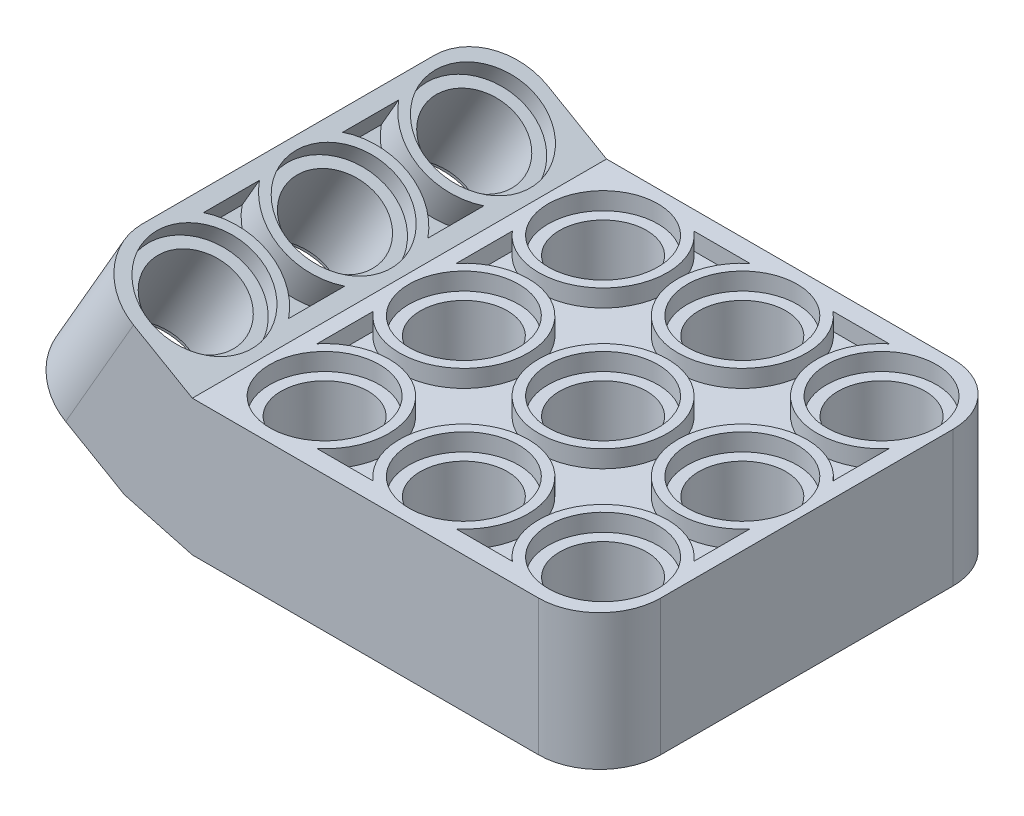
from build123d import *

# Parameters (mm, degrees)
SKETCH_1_W                  = 23.4
SKETCH_1_H                  = 7.8
EXTRUDE_1_DEPTH             = 23.8
CUT_EXTRUDE_1_REACH         = 37.953
CUT_EXTRUDE_2_DEPTH         = 1
CUT_EXTRUDE_START           = -6.8
CUT_EXTRUDE_3_DEPTH         = 1
PATTERN_LINEAR_1_COUNT      = 2
PATTERN_LINEAR_1_PITCH      = 8
PATTERN_LINEAR_1_COL_COUNT  = 2
PATTERN_LINEAR_1_COL_PITCH  = 8
CUT_EXTRUDE_4_DEPTH         = 2
CUT_EXTRUDE_START_2         = -5.8
CUT_EXTRUDE_5_DEPTH         = 2
PATTERN_LINEAR_2_COUNT      = 2
PATTERN_LINEAR_2_PITCH      = 8
CUT_EXTRUDE_6_REACH         = 37.302
SKETCH_5_R                  = 2.5
SKETCH_5_3_R                = 3.15
SKETCH_5_3_R_2              = 2.5
CUT_EXTRUDE_7_DEPTH         = 1
SKETCH_5_4_R                = 3.15
SKETCH_5_4_R_2              = 2.5
CUT_EXTRUDE_8_DEPTH         = 1
PATTERN_LINEAR_3_COUNT      = 2
PATTERN_LINEAR_3_PITCH      = 8
PATTERN_LINEAR_3_COL_COUNT  = 2
PATTERN_LINEAR_3_COL_PITCH  = 8
CUT_EXTRUDE_10_DEPTH        = 1
CUT_EXTRUDE_11_DEPTH        = 1
PATTERN_LINEAR_4_COUNT      = 2
PATTERN_LINEAR_4_PITCH      = 8
PATTERN_LINEAR_4_COUNT_DIR2 = 3
PATTERN_LINEAR_4_PITCH_DIR2 = 8
CUT_EXTRUDE_12_DEPTH        = 1
CUT_EXTRUDE_13_DEPTH        = 1
PATTERN_LINEAR_5_COUNT      = 3
PATTERN_LINEAR_5_PITCH      = 8
PATTERN_LINEAR_5_COUNT_DIR2 = 2
PATTERN_LINEAR_5_PITCH_DIR2 = 8
SKETCH_6_W                  = 2.35
SKETCH_6_H                  = 2.35
CUT_EXTRUDE_14_DEPTH        = 1
CUT_EXTRUDE_START_3         = -7.8
SKETCH_6_2_W                = 2.35
SKETCH_6_2_H                = 2.35
CUT_EXTRUDE_15_DEPTH        = 1
FILLET_1_R                  = 3.5


with BuildPart() as part:
    # 草图1 → 凸台-拉伸1 (new body)
    with BuildSketch(Plane.XY):
        Polygon((-6.408587988, 11.5), (0, 7.8), (-3.9, 1.04500185), (-10.308587988, 4.74500185), align=None)
        with Locations((11.7, 3.9)):
            Rectangle(SKETCH_1_W, SKETCH_1_H)
        Polygon((-3.9, 1.04500185), (0, 7.8), (0, 0), align=None)
    extrude(amount=EXTRUDE_1_DEPTH)

    # 草图2 → 切除-拉伸1 (cut, up to next)
    with BuildSketch(Plane(origin=(-0.522500925, -0.90499815, 0), x_dir=(-0.8660254037844388, 0.49999999999999967, 0), z_dir=(-0.49999999999999967, -0.8660254037844388, 0)), mode=Mode.PRIVATE) as cut_extrude_1_sk1:
        with BuildLine():
            ThreePointArc((5.1, -11.9), (5.832233047, -13.667766953), (7.6, -14.4))
            Line((7.6, -14.4), (7.6, -11.9))
            Line((7.6, -11.9), (5.1, -11.9))
        make_face()
    cut_extrude_1_tool1 = extrude(cut_extrude_1_sk1.sketch, amount=-CUT_EXTRUDE_1_REACH, mode=Mode.PRIVATE) & part.part
    # 草图2 → 切除-拉伸1 (cut, up to next)
    with BuildSketch(Plane(origin=(-0.522500925, -0.90499815, 0), x_dir=(-0.8660254037844388, 0.49999999999999967, 0), z_dir=(-0.49999999999999967, -0.8660254037844388, 0)), mode=Mode.PRIVATE) as cut_extrude_1_sk2:
        with BuildLine():
            Line((7.6, -11.9), (7.6, -14.4))
            ThreePointArc((7.6, -14.4), (9.367766953, -13.667766953), (10.1, -11.9))
            Line((10.1, -11.9), (7.6, -11.9))
        make_face()
    cut_extrude_1_tool2 = extrude(cut_extrude_1_sk2.sketch, amount=-CUT_EXTRUDE_1_REACH, mode=Mode.PRIVATE) & part.part
    # 草图2 → 切除-拉伸1 (cut, up to next)
    with BuildSketch(Plane(origin=(-0.522500925, -0.90499815, 0), x_dir=(-0.8660254037844388, 0.49999999999999967, 0), z_dir=(-0.49999999999999967, -0.8660254037844388, 0)), mode=Mode.PRIVATE) as cut_extrude_1_sk3:
        with BuildLine():
            Line((5.1, -11.9), (7.6, -11.9))
            Line((7.6, -11.9), (7.6, -9.4))
            ThreePointArc((7.6, -9.4), (5.832233047, -10.132233047), (5.1, -11.9))
        make_face()
    cut_extrude_1_tool3 = extrude(cut_extrude_1_sk3.sketch, amount=-CUT_EXTRUDE_1_REACH, mode=Mode.PRIVATE) & part.part
    # 草图2 → 切除-拉伸1 (cut, up to next)
    with BuildSketch(Plane(origin=(-0.522500925, -0.90499815, 0), x_dir=(-0.8660254037844388, 0.49999999999999967, 0), z_dir=(-0.49999999999999967, -0.8660254037844388, 0)), mode=Mode.PRIVATE) as cut_extrude_1_sk4:
        with BuildLine():
            Line((7.6, -9.4), (7.6, -11.9))
            Line((7.6, -11.9), (10.1, -11.9))
            ThreePointArc((10.1, -11.9), (9.367766953, -10.132233047), (7.6, -9.4))
        make_face()
    cut_extrude_1_tool4 = extrude(cut_extrude_1_sk4.sketch, amount=-CUT_EXTRUDE_1_REACH, mode=Mode.PRIVATE) & part.part
    # 草图2 → 切除-拉伸1 (cut, up to next)
    with BuildSketch(Plane(origin=(-0.522500925, -0.90499815, 0), x_dir=(-0.8660254037844388, 0.49999999999999967, 0), z_dir=(-0.49999999999999967, -0.8660254037844388, 0)), mode=Mode.PRIVATE) as cut_extrude_1_sk5:
        with BuildLine():
            ThreePointArc((5.1, -11.9), (5.832233047, -13.667766953), (7.6, -14.4))
            Line((7.6, -14.4), (7.6, -11.9))
            Line((7.6, -11.9), (5.1, -11.9))
        make_face()
    cut_extrude_1_tool5 = extrude(cut_extrude_1_sk5.sketch, amount=-CUT_EXTRUDE_1_REACH, mode=Mode.PRIVATE) & part.part
    # 草图2 → 切除-拉伸1 (cut, up to next)
    with BuildSketch(Plane(origin=(-0.522500925, -0.90499815, 0), x_dir=(-0.8660254037844388, 0.49999999999999967, 0), z_dir=(-0.49999999999999967, -0.8660254037844388, 0)), mode=Mode.PRIVATE) as cut_extrude_1_sk6:
        with BuildLine():
            Line((7.6, -11.9), (7.6, -14.4))
            ThreePointArc((7.6, -14.4), (9.367766953, -13.667766953), (10.1, -11.9))
            Line((10.1, -11.9), (7.6, -11.9))
        make_face()
    cut_extrude_1_tool6 = extrude(cut_extrude_1_sk6.sketch, amount=-CUT_EXTRUDE_1_REACH, mode=Mode.PRIVATE) & part.part
    # 草图2 → 切除-拉伸1 (cut, up to next)
    with BuildSketch(Plane(origin=(-0.522500925, -0.90499815, 0), x_dir=(-0.8660254037844388, 0.49999999999999967, 0), z_dir=(-0.49999999999999967, -0.8660254037844388, 0)), mode=Mode.PRIVATE) as cut_extrude_1_sk7:
        with BuildLine():
            Line((5.1, -11.9), (7.6, -11.9))
            Line((7.6, -11.9), (7.6, -9.4))
            ThreePointArc((7.6, -9.4), (5.832233047, -10.132233047), (5.1, -11.9))
        make_face()
    cut_extrude_1_tool7 = extrude(cut_extrude_1_sk7.sketch, amount=-CUT_EXTRUDE_1_REACH, mode=Mode.PRIVATE) & part.part
    # 草图2 → 切除-拉伸1 (cut, up to next)
    with BuildSketch(Plane(origin=(-0.522500925, -0.90499815, 0), x_dir=(-0.8660254037844388, 0.49999999999999967, 0), z_dir=(-0.49999999999999967, -0.8660254037844388, 0)), mode=Mode.PRIVATE) as cut_extrude_1_sk8:
        with BuildLine():
            Line((7.6, -9.4), (7.6, -11.9))
            Line((7.6, -11.9), (10.1, -11.9))
            ThreePointArc((10.1, -11.9), (9.367766953, -10.132233047), (7.6, -9.4))
        make_face()
    cut_extrude_1_tool8 = extrude(cut_extrude_1_sk8.sketch, amount=-CUT_EXTRUDE_1_REACH, mode=Mode.PRIVATE) & part.part
    # 草图2 → 切除-拉伸1 (cut, up to next)
    with BuildSketch(Plane(origin=(-0.522500925, -0.90499815, 0), x_dir=(-0.8660254037844388, 0.49999999999999967, 0), z_dir=(-0.49999999999999967, -0.8660254037844388, 0)), mode=Mode.PRIVATE) as cut_extrude_1_sk9:
        with BuildLine():
            ThreePointArc((5.1, -11.9), (5.832233047, -13.667766953), (7.6, -14.4))
            Line((7.6, -14.4), (7.6, -11.9))
            Line((7.6, -11.9), (5.1, -11.9))
        make_face()
    cut_extrude_1_tool9 = extrude(cut_extrude_1_sk9.sketch, amount=-CUT_EXTRUDE_1_REACH, mode=Mode.PRIVATE) & part.part
    # 草图2 → 切除-拉伸1 (cut, up to next)
    with BuildSketch(Plane(origin=(-0.522500925, -0.90499815, 0), x_dir=(-0.8660254037844388, 0.49999999999999967, 0), z_dir=(-0.49999999999999967, -0.8660254037844388, 0)), mode=Mode.PRIVATE) as cut_extrude_1_sk10:
        with BuildLine():
            Line((7.6, -11.9), (7.6, -14.4))
            ThreePointArc((7.6, -14.4), (9.367766953, -13.667766953), (10.1, -11.9))
            Line((10.1, -11.9), (7.6, -11.9))
        make_face()
    cut_extrude_1_tool10 = extrude(cut_extrude_1_sk10.sketch, amount=-CUT_EXTRUDE_1_REACH, mode=Mode.PRIVATE) & part.part
    # 草图2 → 切除-拉伸1 (cut, up to next)
    with BuildSketch(Plane(origin=(-0.522500925, -0.90499815, 0), x_dir=(-0.8660254037844388, 0.49999999999999967, 0), z_dir=(-0.49999999999999967, -0.8660254037844388, 0)), mode=Mode.PRIVATE) as cut_extrude_1_sk11:
        with BuildLine():
            Line((5.1, -11.9), (7.6, -11.9))
            Line((7.6, -11.9), (7.6, -9.4))
            ThreePointArc((7.6, -9.4), (5.832233047, -10.132233047), (5.1, -11.9))
        make_face()
    cut_extrude_1_tool11 = extrude(cut_extrude_1_sk11.sketch, amount=-CUT_EXTRUDE_1_REACH, mode=Mode.PRIVATE) & part.part
    # 草图2 → 切除-拉伸1 (cut, up to next)
    with BuildSketch(Plane(origin=(-0.522500925, -0.90499815, 0), x_dir=(-0.8660254037844388, 0.49999999999999967, 0), z_dir=(-0.49999999999999967, -0.8660254037844388, 0)), mode=Mode.PRIVATE) as cut_extrude_1_sk12:
        with BuildLine():
            Line((7.6, -9.4), (7.6, -11.9))
            Line((7.6, -11.9), (10.1, -11.9))
            ThreePointArc((10.1, -11.9), (9.367766953, -10.132233047), (7.6, -9.4))
        make_face()
    cut_extrude_1_tool12 = extrude(cut_extrude_1_sk12.sketch, amount=-CUT_EXTRUDE_1_REACH, mode=Mode.PRIVATE) & part.part
    # 草图2 → 切除-拉伸1 (cut, up to next)
    with BuildSketch(Plane(origin=(-0.522500925, -0.90499815, 0), x_dir=(-0.8660254037844388, 0.49999999999999967, 0), z_dir=(-0.49999999999999967, -0.8660254037844388, 0)), mode=Mode.PRIVATE) as cut_extrude_1_sk13:
        with BuildLine():
            ThreePointArc((5.1, -11.9), (5.832233047, -13.667766953), (7.6, -14.4))
            Line((7.6, -14.4), (7.6, -11.9))
            Line((7.6, -11.9), (5.1, -11.9))
        make_face()
    cut_extrude_1_tool13 = extrude(cut_extrude_1_sk13.sketch, amount=-CUT_EXTRUDE_1_REACH, mode=Mode.PRIVATE) & part.part
    # 草图2 → 切除-拉伸1 (cut, up to next)
    with BuildSketch(Plane(origin=(-0.522500925, -0.90499815, 0), x_dir=(-0.8660254037844388, 0.49999999999999967, 0), z_dir=(-0.49999999999999967, -0.8660254037844388, 0)), mode=Mode.PRIVATE) as cut_extrude_1_sk14:
        with BuildLine():
            Line((7.6, -11.9), (7.6, -14.4))
            ThreePointArc((7.6, -14.4), (9.367766953, -13.667766953), (10.1, -11.9))
            Line((10.1, -11.9), (7.6, -11.9))
        make_face()
    cut_extrude_1_tool14 = extrude(cut_extrude_1_sk14.sketch, amount=-CUT_EXTRUDE_1_REACH, mode=Mode.PRIVATE) & part.part
    # 草图2 → 切除-拉伸1 (cut, up to next)
    with BuildSketch(Plane(origin=(-0.522500925, -0.90499815, 0), x_dir=(-0.8660254037844388, 0.49999999999999967, 0), z_dir=(-0.49999999999999967, -0.8660254037844388, 0)), mode=Mode.PRIVATE) as cut_extrude_1_sk15:
        with BuildLine():
            Line((5.1, -11.9), (7.6, -11.9))
            Line((7.6, -11.9), (7.6, -9.4))
            ThreePointArc((7.6, -9.4), (5.832233047, -10.132233047), (5.1, -11.9))
        make_face()
    cut_extrude_1_tool15 = extrude(cut_extrude_1_sk15.sketch, amount=-CUT_EXTRUDE_1_REACH, mode=Mode.PRIVATE) & part.part
    # 草图2 → 切除-拉伸1 (cut, up to next)
    with BuildSketch(Plane(origin=(-0.522500925, -0.90499815, 0), x_dir=(-0.8660254037844388, 0.49999999999999967, 0), z_dir=(-0.49999999999999967, -0.8660254037844388, 0)), mode=Mode.PRIVATE) as cut_extrude_1_sk16:
        with BuildLine():
            Line((7.6, -9.4), (7.6, -11.9))
            Line((7.6, -11.9), (10.1, -11.9))
            ThreePointArc((10.1, -11.9), (9.367766953, -10.132233047), (7.6, -9.4))
        make_face()
    cut_extrude_1_tool16 = extrude(cut_extrude_1_sk16.sketch, amount=-CUT_EXTRUDE_1_REACH, mode=Mode.PRIVATE) & part.part
    cut_extrude_1_1 = cut_extrude_1_tool1.solids().sort_by_distance((-6.185413, 2.364485, 12.961033))[0]
    add(cut_extrude_1_1, mode=Mode.SUBTRACT)
    cut_extrude_1_2 = cut_extrude_1_tool2.solids().sort_by_distance((-8.023175, 3.425518, 12.961033))[0]
    add(cut_extrude_1_2, mode=Mode.SUBTRACT)
    cut_extrude_1_3 = cut_extrude_1_tool3.solids().sort_by_distance((-6.185413, 2.364485, 10.838967))[0]
    add(cut_extrude_1_3, mode=Mode.SUBTRACT)
    cut_extrude_1_4 = cut_extrude_1_tool4.solids().sort_by_distance((-8.023175, 3.425518, 10.838967))[0]
    add(cut_extrude_1_4, mode=Mode.SUBTRACT)
    cut_extrude_1_5 = cut_extrude_1_tool5.solids().sort_by_distance((-6.185413, 2.364485, 12.961033))[0]
    add(cut_extrude_1_5, mode=Mode.SUBTRACT)
    cut_extrude_1_6 = cut_extrude_1_tool6.solids().sort_by_distance((-8.023175, 3.425518, 12.961033))[0]
    add(cut_extrude_1_6, mode=Mode.SUBTRACT)
    cut_extrude_1_7 = cut_extrude_1_tool7.solids().sort_by_distance((-6.185413, 2.364485, 10.838967))[0]
    add(cut_extrude_1_7, mode=Mode.SUBTRACT)
    cut_extrude_1_8 = cut_extrude_1_tool8.solids().sort_by_distance((-8.023175, 3.425518, 10.838967))[0]
    add(cut_extrude_1_8, mode=Mode.SUBTRACT)
    cut_extrude_1_9 = cut_extrude_1_tool9.solids().sort_by_distance((-6.185413, 2.364485, 12.961033))[0]
    add(cut_extrude_1_9, mode=Mode.SUBTRACT)
    cut_extrude_1_10 = cut_extrude_1_tool10.solids().sort_by_distance((-8.023175, 3.425518, 12.961033))[0]
    add(cut_extrude_1_10, mode=Mode.SUBTRACT)
    cut_extrude_1_11 = cut_extrude_1_tool11.solids().sort_by_distance((-6.185413, 2.364485, 10.838967))[0]
    add(cut_extrude_1_11, mode=Mode.SUBTRACT)
    cut_extrude_1_12 = cut_extrude_1_tool12.solids().sort_by_distance((-8.023175, 3.425518, 10.838967))[0]
    add(cut_extrude_1_12, mode=Mode.SUBTRACT)
    cut_extrude_1_13 = cut_extrude_1_tool13.solids().sort_by_distance((-6.185413, 2.364485, 12.961033))[0]
    add(cut_extrude_1_13, mode=Mode.SUBTRACT)
    cut_extrude_1_14 = cut_extrude_1_tool14.solids().sort_by_distance((-8.023175, 3.425518, 12.961033))[0]
    add(cut_extrude_1_14, mode=Mode.SUBTRACT)
    cut_extrude_1_15 = cut_extrude_1_tool15.solids().sort_by_distance((-6.185413, 2.364485, 10.838967))[0]
    add(cut_extrude_1_15, mode=Mode.SUBTRACT)
    cut_extrude_1_16 = cut_extrude_1_tool16.solids().sort_by_distance((-8.023175, 3.425518, 10.838967))[0]
    add(cut_extrude_1_16, mode=Mode.SUBTRACT)
    cut_extrude_1 = cut_extrude_1_1 + cut_extrude_1_2 + cut_extrude_1_3 + cut_extrude_1_4 + cut_extrude_1_5 + cut_extrude_1_6 + cut_extrude_1_7 + cut_extrude_1_8 + cut_extrude_1_9 + cut_extrude_1_10 + cut_extrude_1_11 + cut_extrude_1_12 + cut_extrude_1_13 + cut_extrude_1_14 + cut_extrude_1_15 + cut_extrude_1_16  # 切除-拉伸1 as one shape, for the pattern or mirror that repeats it

    # 草图2<3> → 切除-拉伸2 (cut)
    with BuildSketch(Plane(origin=(-0.522500925, -0.90499815, 0), x_dir=(-0.8660254037844388, 0.49999999999999967, 0), z_dir=(-0.49999999999999967, -0.8660254037844388, 0))):
        with BuildLine():
            ThreePointArc((4.45, -11.9), (5.372613639, -14.127386361), (7.6, -15.05))
            Line((7.6, -15.05), (7.6, -14.4))
            ThreePointArc((7.6, -14.4), (5.832233047, -13.667766953), (5.1, -11.9))
            Line((5.1, -11.9), (4.45, -11.9))
        make_face()
        with BuildLine():
            Line((7.6, -14.4), (7.6, -15.05))
            ThreePointArc((7.6, -15.05), (9.827386361, -14.127386361), (10.75, -11.9))
            Line((10.75, -11.9), (10.1, -11.9))
            ThreePointArc((10.1, -11.9), (9.367766953, -13.667766953), (7.6, -14.4))
        make_face()
        with BuildLine():
            ThreePointArc((7.6, -8.75), (5.372613639, -9.672613639), (4.45, -11.9))
            Line((4.45, -11.9), (5.1, -11.9))
            ThreePointArc((5.1, -11.9), (5.832233047, -10.132233047), (7.6, -9.4))
            Line((7.6, -9.4), (7.6, -8.75))
        make_face()
        with BuildLine():
            Line((10.1, -11.9), (10.75, -11.9))
            ThreePointArc((10.75, -11.9), (9.827386361, -9.672613639), (7.6, -8.75))
            Line((7.6, -8.75), (7.6, -9.4))
            ThreePointArc((7.6, -9.4), (9.367766953, -10.132233047), (10.1, -11.9))
        make_face()
    cut_extrude_2 = extrude(amount=-CUT_EXTRUDE_2_DEPTH, mode=Mode.SUBTRACT)

    # 草图2<4> → 切除-拉伸3 (cut)
    with BuildSketch(Plane(origin=(-0.522500925, -0.90499815, 0), x_dir=(-0.8660254037844388, 0.49999999999999967, 0), z_dir=(-0.49999999999999967, -0.8660254037844388, 0)).offset(CUT_EXTRUDE_START)):
        with BuildLine():
            ThreePointArc((4.45, -11.9), (5.372613639, -14.127386361), (7.6, -15.05))
            Line((7.6, -15.05), (7.6, -14.4))
            ThreePointArc((7.6, -14.4), (5.832233047, -13.667766953), (5.1, -11.9))
            Line((5.1, -11.9), (4.45, -11.9))
        make_face()
        with BuildLine():
            Line((7.6, -14.4), (7.6, -15.05))
            ThreePointArc((7.6, -15.05), (9.827386361, -14.127386361), (10.75, -11.9))
            Line((10.75, -11.9), (10.1, -11.9))
            ThreePointArc((10.1, -11.9), (9.367766953, -13.667766953), (7.6, -14.4))
        make_face()
        with BuildLine():
            ThreePointArc((7.6, -8.75), (5.372613639, -9.672613639), (4.45, -11.9))
            Line((4.45, -11.9), (5.1, -11.9))
            ThreePointArc((5.1, -11.9), (5.832233047, -10.132233047), (7.6, -9.4))
            Line((7.6, -9.4), (7.6, -8.75))
        make_face()
        with BuildLine():
            Line((10.1, -11.9), (10.75, -11.9))
            ThreePointArc((10.75, -11.9), (9.827386361, -9.672613639), (7.6, -8.75))
            Line((7.6, -8.75), (7.6, -9.4))
            ThreePointArc((7.6, -9.4), (9.367766953, -10.132233047), (10.1, -11.9))
        make_face()
    cut_extrude_3 = extrude(amount=-CUT_EXTRUDE_3_DEPTH, mode=Mode.SUBTRACT)

    # 阵列(线性)1: 切除-拉伸1, 切除-拉伸2, 切除-拉伸3 ×2
    with Locations(*[(0, 0, -i * PATTERN_LINEAR_1_PITCH) for i in range(1, PATTERN_LINEAR_1_COUNT)]):
        add(cut_extrude_1, mode=Mode.SUBTRACT)
        add(cut_extrude_2, mode=Mode.SUBTRACT)
        add(cut_extrude_3, mode=Mode.SUBTRACT)

    # 阵列(线性)1 col: 切除-拉伸1, 切除-拉伸2, 切除-拉伸3 ×2
    with Locations(*[(0, 0, i * PATTERN_LINEAR_1_COL_PITCH) for i in range(1, PATTERN_LINEAR_1_COL_COUNT)]):
        add(cut_extrude_1, mode=Mode.SUBTRACT)
        add(cut_extrude_2, mode=Mode.SUBTRACT)
        add(cut_extrude_3, mode=Mode.SUBTRACT)

    # 草图4 → 切除-拉伸4 (cut)
    with BuildSketch(Plane(origin=(-0.522500925, -0.90499815, 0), x_dir=(0.8660254037844384, -0.5000000000000006, 0), z_dir=(-0.5000000000000006, -0.8660254037844384, 0))):
        with BuildLine():
            ThreePointArc((-7.6, 8.2), (-9.157098192, 8.543596386), (-10.425, 9.510570152))
            Line((-10.425, 9.510570152), (-10.425, 6.289429848))
            ThreePointArc((-10.425, 6.289429848), (-9.157098192, 7.256403614), (-7.6, 7.6))
            Line((-7.6, 7.6), (-7.6, 8.2))
        make_face()
        with BuildLine():
            Line((-4.775, 6.289429848), (-4.775, 9.510570152))
            ThreePointArc((-4.775, 9.510570152), (-6.042901808, 8.543596386), (-7.6, 8.2))
            Line((-7.6, 8.2), (-7.6, 7.6))
            ThreePointArc((-7.6, 7.6), (-6.042901808, 7.256403614), (-4.775, 6.289429848))
        make_face()
    cut_extrude_4 = extrude(amount=-CUT_EXTRUDE_4_DEPTH, mode=Mode.SUBTRACT)

    # 草图4<3> → 切除-拉伸5 (cut)
    with BuildSketch(Plane(origin=(-0.522500925, -0.90499815, 0), x_dir=(0.8660254037844384, -0.5000000000000006, 0), z_dir=(-0.5000000000000006, -0.8660254037844384, 0)).offset(CUT_EXTRUDE_START_2)):
        with BuildLine():
            ThreePointArc((-7.6, 8.2), (-9.157098192, 8.543596386), (-10.425, 9.510570152))
            Line((-10.425, 9.510570152), (-10.425, 6.289429848))
            ThreePointArc((-10.425, 6.289429848), (-9.157098192, 7.256403614), (-7.6, 7.6))
            Line((-7.6, 7.6), (-7.6, 8.2))
        make_face()
        with BuildLine():
            Line((-4.775, 6.289429848), (-4.775, 9.510570152))
            ThreePointArc((-4.775, 9.510570152), (-6.042901808, 8.543596386), (-7.6, 8.2))
            Line((-7.6, 8.2), (-7.6, 7.6))
            ThreePointArc((-7.6, 7.6), (-6.042901808, 7.256403614), (-4.775, 6.289429848))
        make_face()
    cut_extrude_5 = extrude(amount=-CUT_EXTRUDE_5_DEPTH, mode=Mode.SUBTRACT)

    # 阵列(线性)2: 切除-拉伸4, 切除-拉伸5 ×2
    with Locations(*[(0, 0, i * PATTERN_LINEAR_2_PITCH) for i in range(1, PATTERN_LINEAR_2_COUNT)]):
        add(cut_extrude_4, mode=Mode.SUBTRACT)
        add(cut_extrude_5, mode=Mode.SUBTRACT)

    # 草图5 → 切除-拉伸6 (cut, up to next)
    with BuildSketch(Plane.XZ, mode=Mode.PRIVATE) as cut_extrude_6_sk1:
        with Locations(Location((11.7, 11.9, 0), (0, 0, 270))):
            Circle(SKETCH_5_R)
    cut_extrude_6_tool1 = extrude(cut_extrude_6_sk1.sketch, amount=-CUT_EXTRUDE_6_REACH, mode=Mode.PRIVATE) & part.part
    # 草图5 → 切除-拉伸6 (cut, up to next)
    with BuildSketch(Plane.XZ, mode=Mode.PRIVATE) as cut_extrude_6_sk2:
        with Locations(Location((19.7, 11.9, 0), (0, 0, 270))):
            Circle(SKETCH_5_R)
    cut_extrude_6_tool2 = extrude(cut_extrude_6_sk2.sketch, amount=-CUT_EXTRUDE_6_REACH, mode=Mode.PRIVATE) & part.part
    # 草图5 → 切除-拉伸6 (cut, up to next)
    with BuildSketch(Plane.XZ, mode=Mode.PRIVATE) as cut_extrude_6_sk3:
        with Locations(Location((3.7, 11.9, 0), (0, 0, 270))):
            Circle(SKETCH_5_R)
    cut_extrude_6_tool3 = extrude(cut_extrude_6_sk3.sketch, amount=-CUT_EXTRUDE_6_REACH, mode=Mode.PRIVATE) & part.part
    cut_extrude_6_1 = cut_extrude_6_tool1.solids().sort_by_distance((11.7, 0, 11.9))[0]
    add(cut_extrude_6_1, mode=Mode.SUBTRACT)
    cut_extrude_6_2 = cut_extrude_6_tool2.solids().sort_by_distance((19.7, 0, 11.9))[0]
    add(cut_extrude_6_2, mode=Mode.SUBTRACT)
    cut_extrude_6_3 = cut_extrude_6_tool3.solids().sort_by_distance((3.7, 0, 11.9))[0]
    add(cut_extrude_6_3, mode=Mode.SUBTRACT)
    cut_extrude_6 = cut_extrude_6_1 + cut_extrude_6_2 + cut_extrude_6_3  # 切除-拉伸6 as one shape, for the pattern or mirror that repeats it

    # 草图5<3> → 切除-拉伸7 (cut)
    # profile 1 of 3: a face of its own
    with BuildSketch(Plane.XZ):
        with Locations(Location((3.7, 11.9, 0), (0, 0, 270))):
            Circle(SKETCH_5_3_R)
        with Locations(Location((3.7, 11.9, 0), (0, 0, 270))):
            Circle(SKETCH_5_3_R_2, mode=Mode.SUBTRACT)
    # profile 2 of 3: a face of its own
    with BuildSketch(Plane.XZ):
        with Locations(Location((19.7, 11.9, 0), (0, 0, 270))):
            Circle(SKETCH_5_3_R)
        with Locations(Location((19.7, 11.9, 0), (0, 0, 270))):
            Circle(SKETCH_5_3_R_2, mode=Mode.SUBTRACT)
    # profile 3 of 3: a face of its own
    with BuildSketch(Plane.XZ):
        with Locations(Location((11.7, 11.9, 0), (0, 0, 270))):
            Circle(SKETCH_5_3_R)
        with Locations(Location((11.7, 11.9, 0), (0, 0, 270))):
            Circle(SKETCH_5_3_R_2, mode=Mode.SUBTRACT)
    cut_extrude_7 = extrude(amount=-CUT_EXTRUDE_7_DEPTH, mode=Mode.SUBTRACT)

    # 草图5<4> → 切除-拉伸8 (cut)
    # profile 1 of 3: a face of its own
    with BuildSketch(Plane.XZ.offset(CUT_EXTRUDE_START)):
        with Locations(Location((11.7, 11.9, 0), (0, 0, 270))):
            Circle(SKETCH_5_4_R)
        with Locations(Location((11.7, 11.9, 0), (0, 0, 270))):
            Circle(SKETCH_5_4_R_2, mode=Mode.SUBTRACT)
    # profile 2 of 3: a face of its own
    with BuildSketch(Plane.XZ.offset(CUT_EXTRUDE_START)):
        with Locations(Location((19.7, 11.9, 0), (0, 0, 270))):
            Circle(SKETCH_5_4_R)
        with Locations(Location((19.7, 11.9, 0), (0, 0, 270))):
            Circle(SKETCH_5_4_R_2, mode=Mode.SUBTRACT)
    # profile 3 of 3: a face of its own
    with BuildSketch(Plane.XZ.offset(CUT_EXTRUDE_START)):
        with Locations(Location((3.7, 11.9, 0), (0, 0, 270))):
            Circle(SKETCH_5_4_R)
        with Locations(Location((3.7, 11.9, 0), (0, 0, 270))):
            Circle(SKETCH_5_4_R_2, mode=Mode.SUBTRACT)
    cut_extrude_8 = extrude(amount=-CUT_EXTRUDE_8_DEPTH, mode=Mode.SUBTRACT)

    # 阵列(线性)3: 切除-拉伸6, 切除-拉伸7, 切除-拉伸8 ×2
    with Locations(*[(0, 0, -i * PATTERN_LINEAR_3_PITCH) for i in range(1, PATTERN_LINEAR_3_COUNT)]):
        add(cut_extrude_6, mode=Mode.SUBTRACT)
        add(cut_extrude_7, mode=Mode.SUBTRACT)
        add(cut_extrude_8, mode=Mode.SUBTRACT)

    # 阵列(线性)3 col: 切除-拉伸6, 切除-拉伸7, 切除-拉伸8 ×2
    with Locations(*[(0, 0, i * PATTERN_LINEAR_3_COL_PITCH) for i in range(1, PATTERN_LINEAR_3_COL_COUNT)]):
        add(cut_extrude_6, mode=Mode.SUBTRACT)
        add(cut_extrude_7, mode=Mode.SUBTRACT)
        add(cut_extrude_8, mode=Mode.SUBTRACT)

    # 草图5<6> → 切除-拉伸10 (cut)
    with BuildSketch(Plane.XZ):
        with BuildLine():
            ThreePointArc((16.875, 17.510570152), (16.012841294, 20.207994608), (17.310570152, 22.725))
            Line((17.310570152, 22.725), (14.089429848, 22.725))
            ThreePointArc((14.089429848, 22.725), (15.056403614, 21.457098192), (15.4, 19.9))
            ThreePointArc((15.4, 19.9), (15.056403614, 18.342901808), (14.089429848, 17.075))
            Line((14.089429848, 17.075), (16.875, 17.075))
            Line((16.875, 17.075), (16.875, 17.510570152))
        make_face()
        with BuildLine():
            Line((16.875, 17.075), (17.310570152, 17.075))
            ThreePointArc((17.310570152, 17.075), (17.08370491, 17.28370491), (16.875, 17.510570152))
            Line((16.875, 17.510570152), (16.875, 17.075))
        make_face()
    cut_extrude_10 = extrude(amount=-CUT_EXTRUDE_10_DEPTH, mode=Mode.SUBTRACT)

    # 草图5<7> → 切除-拉伸11 (cut)
    with BuildSketch(Plane.XZ.offset(CUT_EXTRUDE_START)):
        with BuildLine():
            ThreePointArc((16.875, 17.510570152), (16.012841294, 20.207994608), (17.310570152, 22.725))
            Line((17.310570152, 22.725), (14.089429848, 22.725))
            ThreePointArc((14.089429848, 22.725), (15.056403614, 21.457098192), (15.4, 19.9))
            ThreePointArc((15.4, 19.9), (15.056403614, 18.342901808), (14.089429848, 17.075))
            Line((14.089429848, 17.075), (16.875, 17.075))
            Line((16.875, 17.075), (16.875, 17.510570152))
        make_face()
        with BuildLine():
            Line((16.875, 17.075), (17.310570152, 17.075))
            ThreePointArc((17.310570152, 17.075), (17.08370491, 17.28370491), (16.875, 17.510570152))
            Line((16.875, 17.510570152), (16.875, 17.075))
        make_face()
    cut_extrude_11 = extrude(amount=-CUT_EXTRUDE_11_DEPTH, mode=Mode.SUBTRACT)

    # 阵列(线性)4: 切除-拉伸10, Cut-Extrude 11 2 × 3
    with Locations(*[(-i * PATTERN_LINEAR_4_PITCH, 0, -j * PATTERN_LINEAR_4_PITCH_DIR2) for i in range(PATTERN_LINEAR_4_COUNT) for j in range(PATTERN_LINEAR_4_COUNT_DIR2) if (i, j) != (0, 0)]):
        add(cut_extrude_10, mode=Mode.SUBTRACT)
        add(cut_extrude_11, mode=Mode.SUBTRACT)

    # 草图5<8> → 切除-拉伸12 (cut)
    with BuildSketch(Plane.XZ):
        with BuildLine():
            Line((22.525, 14.289429848), (22.525, 17.510570152))
            ThreePointArc((22.525, 17.510570152), (20.007994608, 16.212841294), (17.310570152, 17.075))
            Line((17.310570152, 17.075), (16.875, 17.075))
            Line((16.875, 17.075), (16.875, 14.289429848))
            ThreePointArc((16.875, 14.289429848), (19.7, 15.6), (22.525, 14.289429848))
        make_face()
        with BuildLine():
            Line((16.875, 17.075), (17.310570152, 17.075))
            ThreePointArc((17.310570152, 17.075), (17.08370491, 17.28370491), (16.875, 17.510570152))
            Line((16.875, 17.510570152), (16.875, 17.075))
        make_face()
    cut_extrude_12 = extrude(amount=-CUT_EXTRUDE_12_DEPTH, mode=Mode.SUBTRACT)

    # 草图5<9> → 切除-拉伸13 (cut)
    with BuildSketch(Plane.XZ.offset(CUT_EXTRUDE_START)):
        with BuildLine():
            Line((22.525, 14.289429848), (22.525, 17.510570152))
            ThreePointArc((22.525, 17.510570152), (20.007994608, 16.212841294), (17.310570152, 17.075))
            Line((17.310570152, 17.075), (16.875, 17.075))
            Line((16.875, 17.075), (16.875, 14.289429848))
            ThreePointArc((16.875, 14.289429848), (19.7, 15.6), (22.525, 14.289429848))
        make_face()
        with BuildLine():
            Line((16.875, 17.075), (17.310570152, 17.075))
            ThreePointArc((17.310570152, 17.075), (17.08370491, 17.28370491), (16.875, 17.510570152))
            Line((16.875, 17.510570152), (16.875, 17.075))
        make_face()
    cut_extrude_13 = extrude(amount=-CUT_EXTRUDE_13_DEPTH, mode=Mode.SUBTRACT)

    # 阵列(线性)5: 切除-拉伸12, Cut-Extrude 13 3 × 2
    with Locations(*[(-i * PATTERN_LINEAR_5_PITCH, 0, -j * PATTERN_LINEAR_5_PITCH_DIR2) for i in range(PATTERN_LINEAR_5_COUNT) for j in range(PATTERN_LINEAR_5_COUNT_DIR2) if (i, j) != (0, 0)]):
        add(cut_extrude_12, mode=Mode.SUBTRACT)
        add(cut_extrude_13, mode=Mode.SUBTRACT)

    # 草图6 → 切除-拉伸14 (cut)
    with BuildSketch(Plane(origin=(0, 7.8, 0), x_dir=(1, 0, 0), z_dir=(0, 1, 0))):
        with Locations((7.7, -7.9)):
            Rectangle(SKETCH_6_W, SKETCH_6_H)
        with Locations((15.7, -7.9)):
            Rectangle(SKETCH_6_W, SKETCH_6_H)
        with Locations((7.7, -15.9)):
            Rectangle(SKETCH_6_W, SKETCH_6_H)
        with Locations((15.7, -15.9)):
            Rectangle(SKETCH_6_W, SKETCH_6_H)
    extrude(amount=-CUT_EXTRUDE_14_DEPTH, mode=Mode.SUBTRACT)

    # 草图6<2> → 切除-拉伸15 (cut)
    with BuildSketch(Plane(origin=(0, 7.8, 0), x_dir=(1, 0, 0), z_dir=(0, 1, 0)).offset(CUT_EXTRUDE_START_3)):
        with Locations((7.7, -7.9)):
            Rectangle(SKETCH_6_2_W, SKETCH_6_2_H)
        with Locations((15.7, -7.9)):
            Rectangle(SKETCH_6_2_W, SKETCH_6_2_H)
        with Locations((7.7, -15.9)):
            Rectangle(SKETCH_6_2_W, SKETCH_6_2_H)
        with Locations((15.7, -15.9)):
            Rectangle(SKETCH_6_2_W, SKETCH_6_2_H)
    extrude(amount=CUT_EXTRUDE_15_DEPTH, mode=Mode.SUBTRACT)

    # 圆角1
    fillet_1_edges = [part.edges().sort_by_distance(p)[0] for p in [
        (-8.358587988, 8.122500925, 23.8),
        (-8.358587988, 8.122500925, 0),
        (23.4, 3.9, 23.8),
        (23.4, 3.9, 0),
    ]]
    fillet(fillet_1_edges, radius=FILLET_1_R)


solid = part.part
